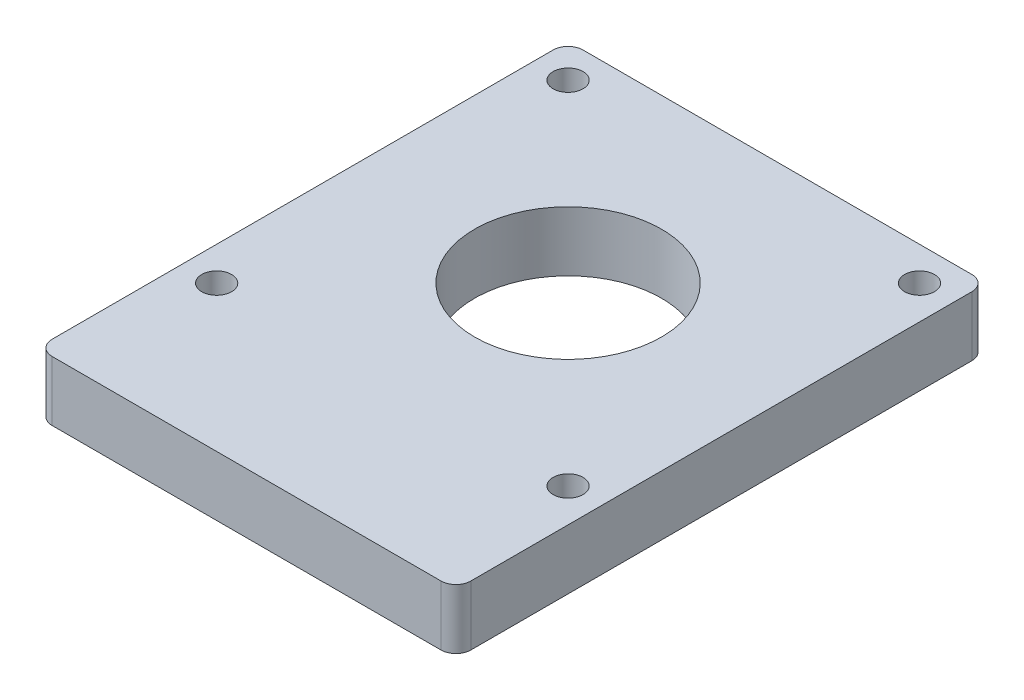
from build123d import *

# Parameters (mm, degrees)
SKETCH1_W           = 56
SKETCH1_H           = 71
BOSS_EXTRUDE1_DEPTH = 8
FILLET1_R           = 2
SKETCH2_R           = 2
SKETCH2_R_2         = 12.5
CUT_EXTRUDE1_DEPTH  = 91.779953734


with BuildPart() as part:
    # Sketch1 → Boss-Extrude1 (new body)
    with BuildSketch(Plane(origin=(0, 0, 0), x_dir=(1, 0, 0), z_dir=(0, 1, 0))):
        with Locations((28, 35.5)):
            Rectangle(SKETCH1_W, SKETCH1_H)
    extrude(amount=BOSS_EXTRUDE1_DEPTH)

    # Fillet1
    fillet1_edges = [part.edges().sort_by_distance(p)[0] for p in [
        (0, 4, -71),
        (56, 4, -71),
        (56, 4, 0),
        (0, 4, 0),
    ]]
    fillet(fillet1_edges, radius=FILLET1_R)

    # Sketch2 → Cut-Extrude1 (cut, through all)
    with BuildSketch(Plane(origin=(0, 8, 0), x_dir=(1, 0, 0), z_dir=(0, 1, 0))):
        with Locations(Location((4.5, 66.5, 0), (0, 0, 270))):
            Circle(SKETCH2_R)
        with Locations(Location((51.5, 66.5, 0), (0, 0, 270))):
            Circle(SKETCH2_R)
        with Locations(Location((51.5, 19.5, 0), (0, 0, 270))):
            Circle(SKETCH2_R)
        with Locations(Location((4.5, 19.5, 0), (0, 0, 270))):
            Circle(SKETCH2_R)
        with Locations(Location((28, 43, 0), (0, 0, 270))):
            Circle(SKETCH2_R_2)
    extrude(amount=-CUT_EXTRUDE1_DEPTH, mode=Mode.SUBTRACT)


solid = part.part
